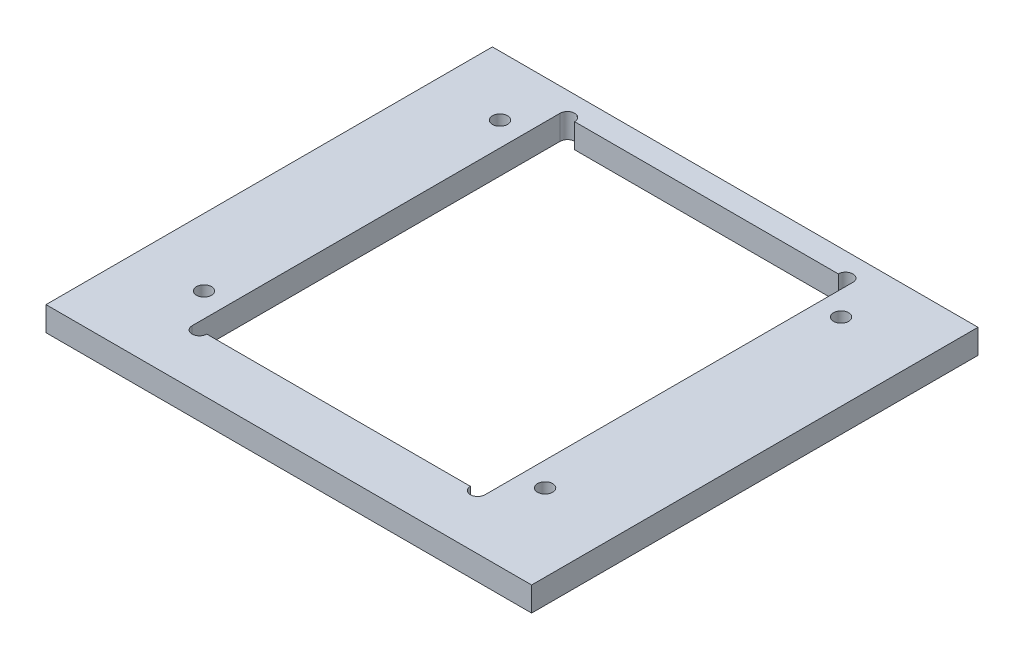
from build123d import *

# Parameters (mm, degrees)
SKETCH_1_W          = 99.656546146
SKETCH_1_H          = 91.603491912
SKETCH_1_W_2        = 60.1
SKETCH_1_H_2        = 75.5
EXTRUDE_1_DEPTH     = 5
SKETCH_2_R          = 1.55
CUT_EXTRUDE_1_DEPTH = 5
SKETCH_3_R          = 1.5
CUT_EXTRUDE_2_DEPTH = 5


with BuildPart() as part:
    # 草图1 → 凸台-拉伸1 (new body)
    with BuildSketch(Plane(origin=(0, 0, 0), x_dir=(1, 0, 0), z_dir=(0, 1, 0))):
        with Locations((1.039363494, -3.201523692)):
            Rectangle(SKETCH_1_W, SKETCH_1_H)
        Rectangle(SKETCH_1_W_2, SKETCH_1_H_2, mode=Mode.SUBTRACT)
    extrude(amount=EXTRUDE_1_DEPTH)

    # 草图2 → 切除-拉伸1 (cut)
    with BuildSketch(Plane(origin=(0, 5, 0), x_dir=(1, 0, 0), z_dir=(0, 1, 0))):
        with Locations(Location((35, 30.369317712, 0), (0, 0, 270))):
            Circle(SKETCH_2_R)
        with Locations(Location((35, -30.369317712, 0), (0, 0, 270))):
            Circle(SKETCH_2_R)
        with Locations(Location((-35, -30.369317712, 0), (0, 0, 270))):
            Circle(SKETCH_2_R)
        with Locations(Location((-35, 30.369317712, 0), (0, 0, 270))):
            Circle(SKETCH_2_R)
    extrude(amount=-CUT_EXTRUDE_1_DEPTH, mode=Mode.SUBTRACT)

    # 草图3 → 切除-拉伸2 (cut)
    with BuildSketch(Plane(origin=(0, 5, 0), x_dir=(1, 0, 0), z_dir=(0, 1, 0))):
        with Locations((28.55, -37.75)):
            Circle(SKETCH_3_R)
        with Locations((28.55, 37.75)):
            Circle(SKETCH_3_R)
        with Locations((-28.55, 37.75)):
            Circle(SKETCH_3_R)
        with Locations((-28.55, -37.75)):
            Circle(SKETCH_3_R)
    extrude(amount=-CUT_EXTRUDE_2_DEPTH, mode=Mode.SUBTRACT)


solid = part.part
